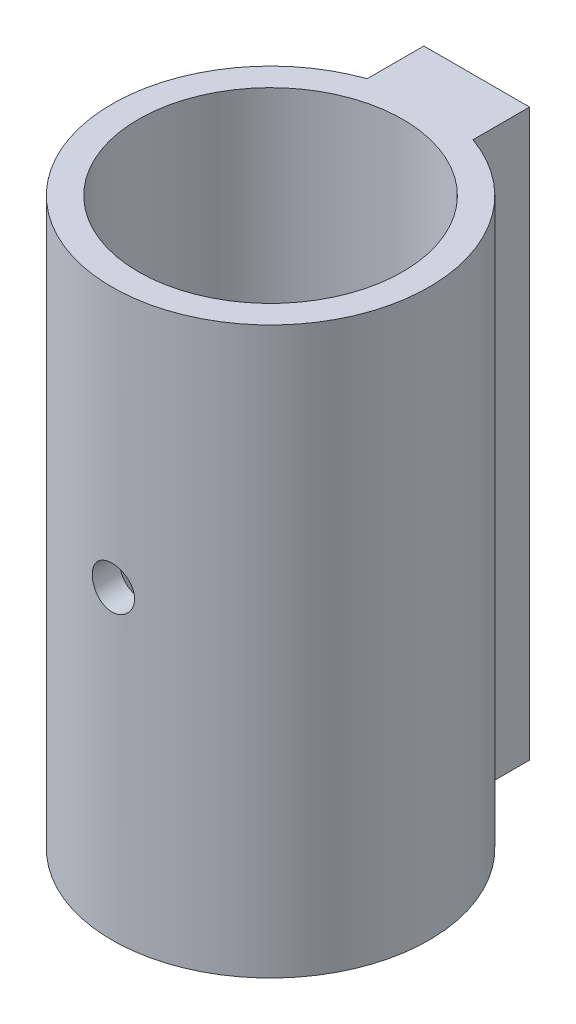
from build123d import *

# Parameters (mm, degrees)
BOSS_EXTRUDE1_DEPTH = 21.4
SKETCH3_R           = 5
CUT_EXTRUDE1_DEPTH  = 24.9
SKETCH4_R           = 1.99
CUT_EXTRUDE2_DEPTH  = 2
SKETCH5_R           = 0.8
CUT_EXTRUDE3_DEPTH  = 26.16346558


with BuildPart() as part:
    # Sketch2 → Boss-Extrude1 (new body)
    with BuildSketch(Plane(origin=(0, 0, 0), x_dir=(1, 0, 0), z_dir=(0, 1, 0))):
        with BuildLine():
            Line((0, 7.8), (-2, 7.8))
            Line((-2, 7.8), (-2, 5.656854249))
            ThreePointArc((-2, 5.656854249), (0, -6), (2, 5.656854249))
            Line((2, 5.656854249), (2, 7.8))
            Line((2, 7.8), (0, 7.8))
        make_face()
    extrude(amount=BOSS_EXTRUDE1_DEPTH)

    # Sketch3 → Cut-Extrude1 (cut)
    with BuildSketch(Plane(origin=(0, 21.4, 0), x_dir=(1, 0, 0), z_dir=(0, 1, 0))):
        with Locations(Location((0, 0, 0), (0, 0, 270))):
            Circle(SKETCH3_R)
    extrude(amount=-CUT_EXTRUDE1_DEPTH, mode=Mode.SUBTRACT)

    # Sketch4 → Cut-Extrude2 (cut)
    with BuildSketch(Plane(origin=(0, 0, -7.8), x_dir=(-1, 0, 0), z_dir=(0, 0, -1))):
        with Locations((0, 11.554448974)):
            Circle(SKETCH4_R)
    extrude(amount=-CUT_EXTRUDE2_DEPTH, mode=Mode.SUBTRACT)

    # Sketch5 → Cut-Extrude3 (cut, through all)
    with BuildSketch(Plane(origin=(0, 0, -5.8), x_dir=(-1, 0, 0), z_dir=(0, 0, -1))):
        with Locations((0, 11.554448974)):
            Circle(SKETCH5_R)
    extrude(amount=-CUT_EXTRUDE3_DEPTH, mode=Mode.SUBTRACT)


solid = part.part
